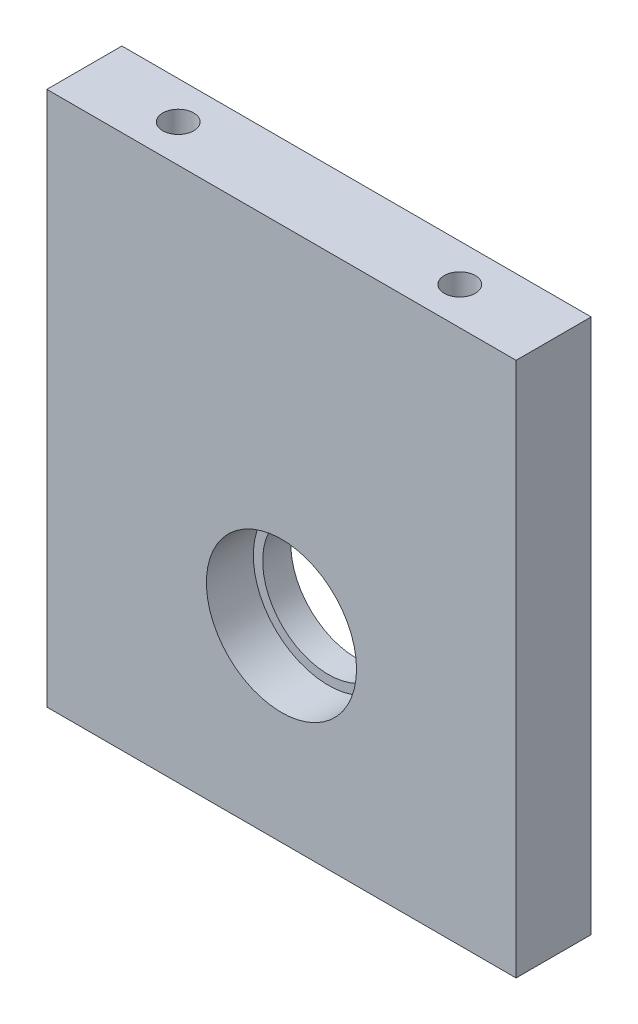
from build123d import *

# Parameters (mm, degrees)
ESQUISSE1_W             = 50
ESQUISSE1_H             = 57
ESQUISSE1_R             = 7
BOSS_EXTRU_1_DEPTH      = 8
ESQUISSE2_R             = 8
ENL_V_MAT_EXTRU_1_DEPTH = 5
ESQUISSE3_R             = 1.65
ENL_V_MAT_EXTRU_2_DEPTH = 10


with BuildPart() as part:
    # Esquisse1 → Boss.-Extru.1 (new body)
    with BuildSketch(Plane.XY):
        with Locations((25, 28.5)):
            Rectangle(ESQUISSE1_W, ESQUISSE1_H)
        with Locations((25, 20)):
            Circle(ESQUISSE1_R, mode=Mode.SUBTRACT)
    extrude(amount=BOSS_EXTRU_1_DEPTH)

    # Esquisse2 → Enlèv. mat.-Extru.1 (cut)
    with BuildSketch(Plane.XY.offset(8)):
        with Locations((25, 20)):
            Circle(ESQUISSE2_R)
    extrude(amount=-ENL_V_MAT_EXTRU_1_DEPTH, mode=Mode.SUBTRACT)

    # Esquisse3 → Enlèv. mat.-Extru.2 (cut)
    with BuildSketch(Plane(origin=(0, 57, 0), x_dir=(1, 0, 0), z_dir=(0, 1, 0))):
        with Locations(Location((10, -4, 0), (0, 0, 270))):
            Circle(ESQUISSE3_R)
        with Locations(Location((40, -4, 0), (0, 0, 90))):
            Circle(ESQUISSE3_R)
    extrude(amount=-ENL_V_MAT_EXTRU_2_DEPTH, mode=Mode.SUBTRACT)


solid = part.part
